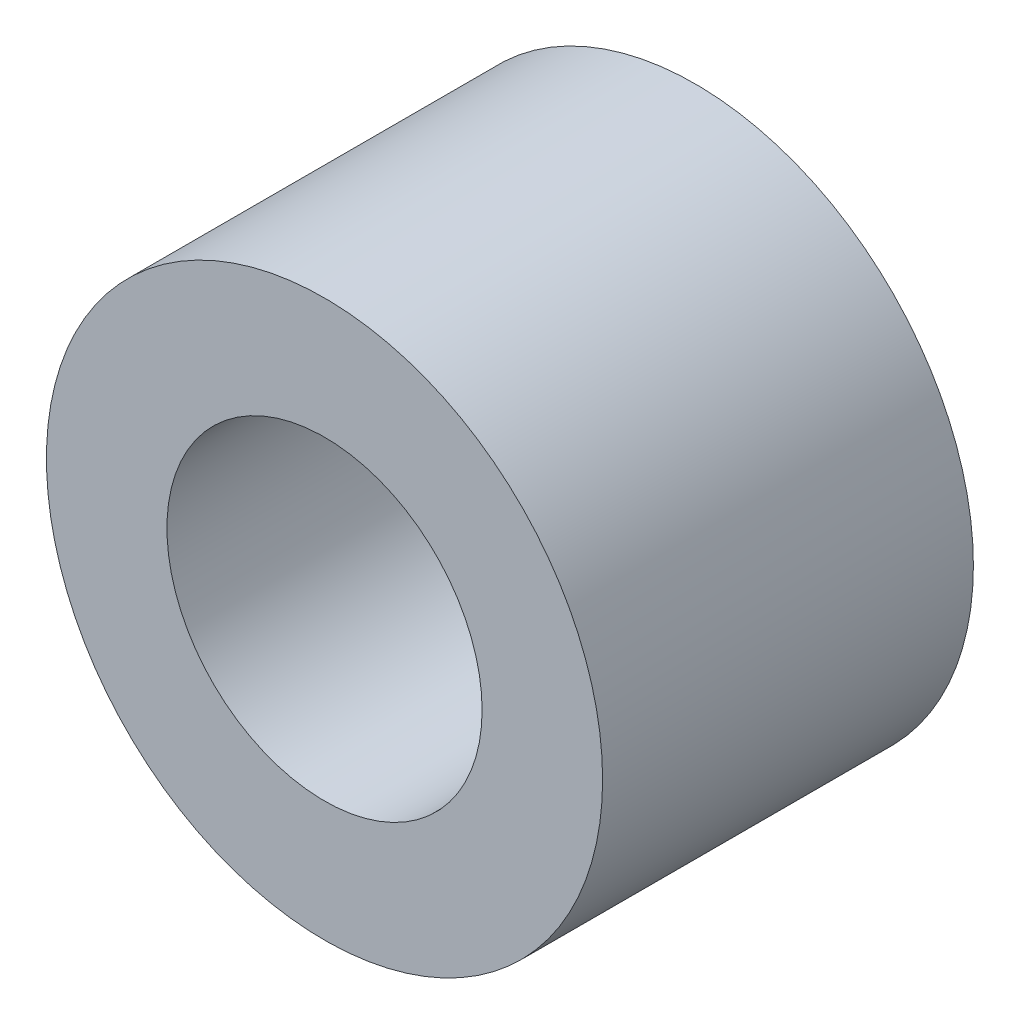
from build123d import *

# Parameters (mm, degrees)
SKETCH1_R    = 3
SKETCH1_R_2  = 1.7
SPACER_DEPTH = 4


with BuildPart() as part:
    # Sketch1 → Spacer (new body)
    with BuildSketch(Plane.XY):
        Circle(SKETCH1_R)
        Circle(SKETCH1_R_2, mode=Mode.SUBTRACT)
    extrude(amount=SPACER_DEPTH)


solid = part.part
